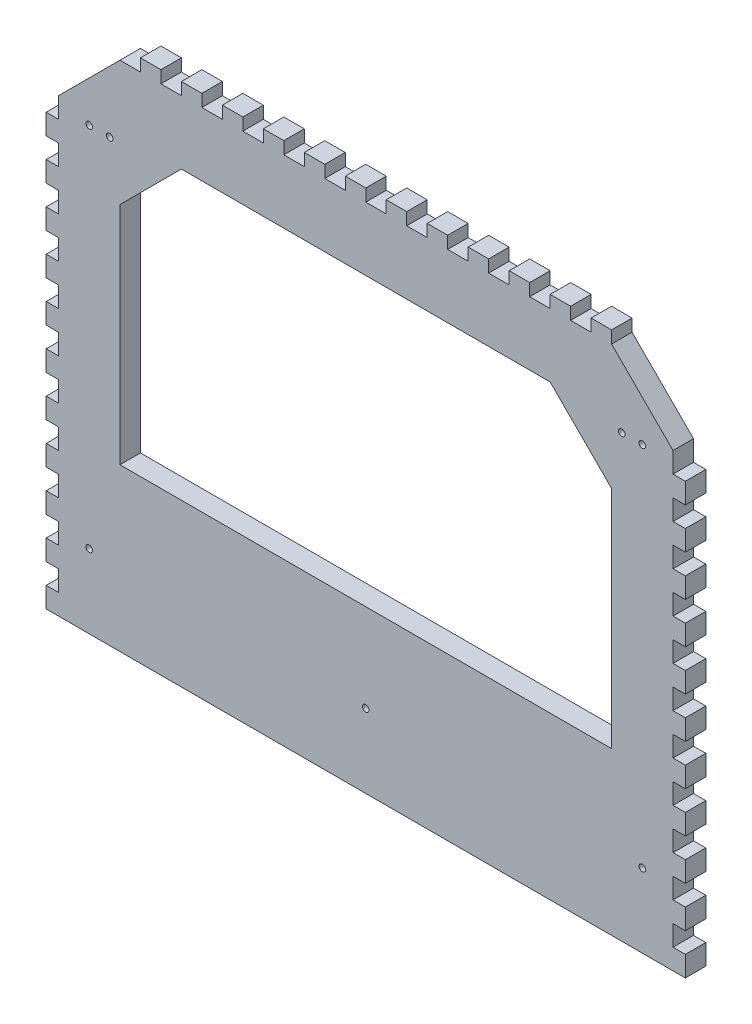
from build123d import *

# Parameters (mm, degrees)
SKIZZE1_R                       = 1.6
AUFSATZ_LINEAR_AUSTRAGEN1_DEPTH = 10


with BuildPart() as part:
    # Skizze1 → Aufsatz-Linear austragen1 (new body)
    with BuildSketch(Plane.XY):
        Polygon((5, 9.999223218), (4.999950827, 19.975708513), (-1, 19.999999998), (-1, 29.999223216), (5, 29.999223216), (4.999950827, 39.975708511), (-1, 39.999999996), (-1, 49.999223214), (5, 49.999223214), (4.999950827, 59.975708509), (-1, 59.999999994), (-1, 69.999223211), (5, 70), (4.999950827, 79.975708506), (-1, 79.999999991), (-1, 89.999223209), (5, 90), (4.999950827, 99.975708504), (-1, 99.999999989), (-1, 109.999223207), (5, 110), (4.999950827, 119.975708502), (-1, 119.999999987), (-1, 129.999223205), (5, 130), (4.999950827, 139.9757085), (-1, 139.999999985), (-1, 149.999223203), (5, 150), (4.999950827, 159.975708498), (-1, 159.999999983), (-1, 169.999223201), (5, 169.999223201), (4.999950827, 179.975708496), (-1, 179.999999981), (-1, 189.999223198), (5, 189.999223198), (4.999950827, 199.975708493), (-1, 199.999999978), (-1, 209.999223196), (5, 209.999223196), (4.999950827, 219.975708491), (5.0000043, 219.999971242), (35.0000043, 249.999971242), (45, 249.999971242), (45, 255.999971242), (55.0000043, 255.999971242), (55.0000043, 249.999971242), (65, 249.999971242), (65, 255.999971242), (75.0000043, 255.999971242), (75.0000043, 249.999971242), (85, 249.999971242), (85, 255.999971242), (95.0000043, 255.999971242), (95.0000043, 249.999971242), (105, 249.999971242), (105, 255.999971242), (115.0000043, 255.999971242), (115.0000043, 249.999971242), (125, 249.999971242), (125, 255.999971242), (135.0000043, 255.999971242), (135.0000043, 249.999971242), (145, 249.999971242), (145, 255.999971242), (155.0000043, 255.999971242), (155.0000043, 249.999971242), (165, 249.999971242), (165, 255.999971242), (175.0000043, 255.999971242), (175.0000043, 249.999971242), (185, 249.999971242), (185, 255.999971242), (195.0000043, 255.999971242), (195.0000043, 249.999971242), (205, 249.999971242), (205, 255.999971242), (215.0000043, 255.999971242), (215.0000043, 249.999971242), (225, 249.999971242), (225, 255.999971242), (235.0000043, 255.999971242), (235.0000043, 249.999971242), (245, 249.999971242), (245, 255.999971242), (255.0000043, 255.999971242), (255.0000043, 249.999971242), (265, 249.999971242), (265, 255.999971242), (275.0000043, 255.999971242), (275.0000043, 249.999971242), (305.0000043, 219.999969416), (304.999999999, 209.999969615), (311, 209.999967035), (311, 199.999972196), (305.0000043, 199.999972196), (304.999999999, 189.999972396), (311, 189.999969815), (311, 179.999974976), (305.0000043, 179.999974976), (304.999999999, 169.999975176), (311, 169.999972595), (311, 159.999977757), (305.0000043, 159.999977757), (304.999999999, 149.999977957), (311, 149.999975376), (311, 139.999980537), (305.0000043, 139.999980537), (304.999999999, 129.999980737), (311, 129.999978156), (311, 119.999983318), (305.0000043, 119.999983318), (304.999999999, 109.999983517), (311, 109.999980937), (311, 99.999986098), (305.0000043, 99.999986098), (304.999999999, 89.999986298), (311, 89.999983717), (311, 79.999988878), (305.0000043, 79.999988878), (304.999999999, 69.999989078), (311, 69.999986497), (311, 59.999991659), (305.0000043, 59.999991659), (304.999999999, 49.999991859), (311, 49.999989278), (311, 39.999994439), (305.0000043, 39.999994439), (304.999999999, 29.999994639), (311, 29.999992058), (311, 19.99999722), (305.0000043, 19.99999722), (304.999999999, 9.999997419), (311, 9.999994839), (311, 0), (305.0000043, 0), (4.956899878, 0), (-1, 0), (-1, 9.999223218), align=None)
        with Locations((290, 214.999999999)):
            Circle(SKIZZE1_R, mode=Mode.SUBTRACT)
        with Locations((280, 214.999999999)):
            Circle(SKIZZE1_R, mode=Mode.SUBTRACT)
        with Locations((20, 215)):
            Circle(SKIZZE1_R, mode=Mode.SUBTRACT)
        with Locations((30, 215)):
            Circle(SKIZZE1_R, mode=Mode.SUBTRACT)
        with Locations((20, 36)):
            Circle(SKIZZE1_R, mode=Mode.SUBTRACT)
        with Locations((155, 36)):
            Circle(SKIZZE1_R, mode=Mode.SUBTRACT)
        with Locations((290, 36)):
            Circle(SKIZZE1_R, mode=Mode.SUBTRACT)
        Polygon((275, 188.971165398), (245, 218.971165398), (65, 218.971165398), (35, 188.971165398), (35, 78.971165398), (275, 78.971165398), align=None, mode=Mode.SUBTRACT)
    extrude(amount=AUFSATZ_LINEAR_AUSTRAGEN1_DEPTH)


solid = part.part
